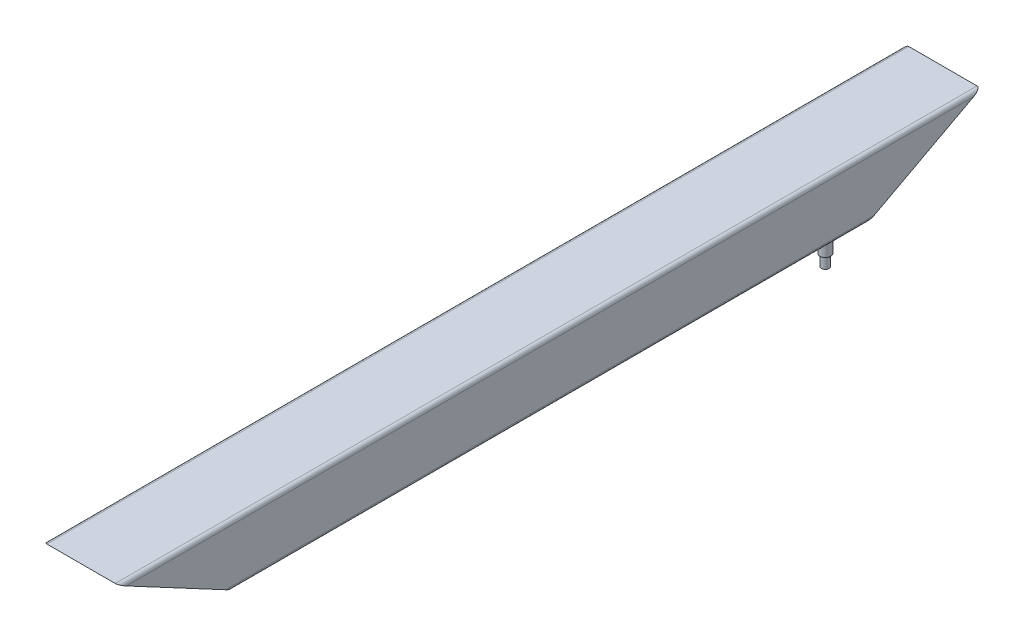
from build123d import *

# Parameters (mm, degrees)
SCHIZZO1_W                   = 88
SCHIZZO1_H                   = 68
ESTRUSIONE_SOTTILE1_DEPTH    = 1200
ESTRUSIONE1_DEPTH            = 1207.813987324
SCHIZZO3_R                   = 3.4
TAGLIO_ESTRUSIONE1_DEPTH     = 10
RIPETIZIONE_A_L1_COUNT       = 2
RIPETIZIONE_A_L1_PITCH       = 40
RIPETIZIONE_A_L1_COUNT_DIR2  = 2
RIPETIZIONE_A_L1_PITCH_DIR2  = 36
SCHIZZO4_R                   = 7
ESTRUSIONE_ESTRUSIONE1_DEPTH = 18
SCHIZZO5_R                   = 5
ESTRUSIONE_ESTRUSIONE2_DEPTH = 15


with BuildPart() as part:
    # Schizzo1 → Estrusione-Sottile1 (new body)
    with BuildSketch(Plane.XY):
        with BuildLine():
            Line((5, 0), (95, 0))
            ThreePointArc((95, 0), (98.535533906, 1.464466094), (100, 5))
            Line((100, 5), (100, 75))
            ThreePointArc((100, 75), (98.535533906, 78.535533906), (95, 80))
            Line((95, 80), (5, 80))
            ThreePointArc((5, 80), (1.464466094, 78.535533906), (0, 75))
            Line((0, 75), (0, 5))
            ThreePointArc((0, 5), (1.464466094, 1.464466094), (5, 0))
        make_face()
        with Locations((50, 40)):
            Rectangle(SCHIZZO1_W, SCHIZZO1_H, mode=Mode.SUBTRACT)
    extrude(amount=ESTRUSIONE_SOTTILE1_DEPTH)

    # Schizzo2 → Estrusione1 (cut, through all)
    with BuildSketch(Plane(origin=(100, 0, 0), x_dir=(0, 0, -1), z_dir=(1, 0, 0))):
        Polygon((-1200, 80), (-1050, 0), (-1200, 0), align=None)
        Polygon((-64, 80), (-214, 0), (0, 0), (0, 80), align=None)
    extrude(amount=-ESTRUSIONE1_DEPTH, mode=Mode.SUBTRACT)

    # Schizzo3 → Taglio-Estrusione1 (cut)
    with BuildSketch(Plane.XZ):
        with Locations(Location((10, 354, 0), (0, 0, 270))):
            Circle(SCHIZZO3_R)
    taglio_estrusione1 = extrude(amount=-TAGLIO_ESTRUSIONE1_DEPTH, mode=Mode.SUBTRACT)

    # Ripetizione a L1: Taglio-Estrusione1 2 × 2
    with Locations(*[(i * RIPETIZIONE_A_L1_PITCH, 0, j * RIPETIZIONE_A_L1_PITCH_DIR2) for i in range(RIPETIZIONE_A_L1_COUNT) for j in range(RIPETIZIONE_A_L1_COUNT_DIR2) if (i, j) != (0, 0)]):
        add(taglio_estrusione1, mode=Mode.SUBTRACT)

    # Schizzo4 → Estrusione-Estrusione1 (add)
    with BuildSketch(Plane.XZ):
        with Locations((88, 257)):
            Circle(SCHIZZO4_R)
    extrude(amount=ESTRUSIONE_ESTRUSIONE1_DEPTH)

    # Schizzo5 → Estrusione-Estrusione2 (add)
    with BuildSketch(Plane.XZ.offset(18)):
        with Locations(Location((88, 257, 0), (0, 0, 270))):
            Circle(SCHIZZO5_R)
    extrude(amount=ESTRUSIONE_ESTRUSIONE2_DEPTH)


solid = part.part
